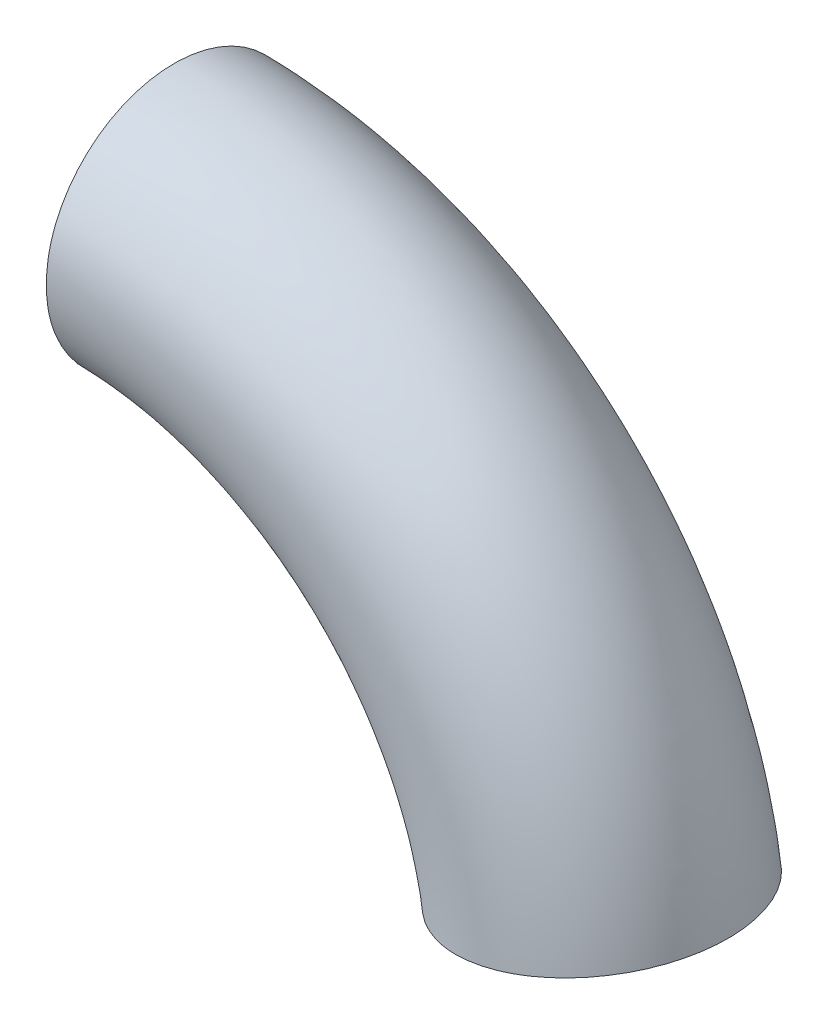
from build123d import *

# Parameters (mm, degrees)
SKETCH1_R   = 52.5
SKETCH1_R_2 = 50


with BuildPart() as part:
    # Sweep7: sweep along a path in Sketch4
    with BuildLine(Plane.XY) as sweep7_path:
        ThreePointArc((0, 0), (115.98913199, -44.399999202), (175.614100109, -153.34816048))
    # Sketch1 → Sweep7 (sweep)
    with BuildSketch(Plane(origin=(0, 0, 0), x_dir=(0, 0, -1), z_dir=(1, 0, 0))):
        Circle(SKETCH1_R)
        Circle(SKETCH1_R_2, mode=Mode.SUBTRACT)
    sweep(path=sweep7_path.line)


solid = part.part
